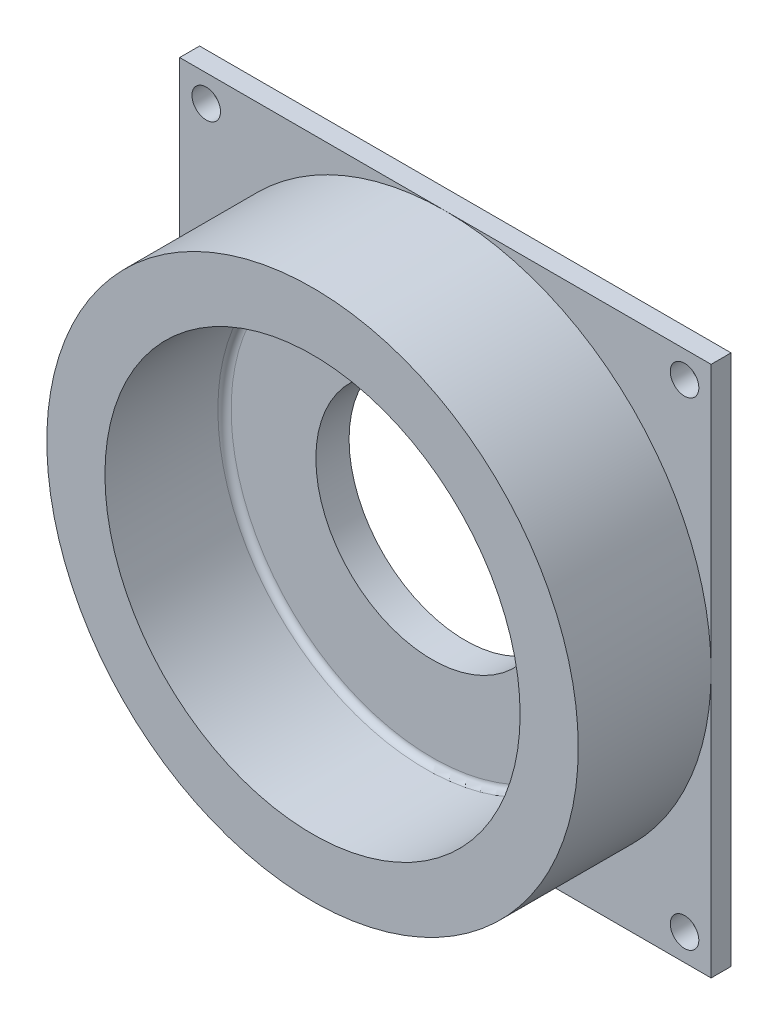
from build123d import *

# Parameters (mm, degrees)
ESQUISSE1_R                  = 40
BOSS_EXTRU_1_DEPTH           = 20
ENL_V_START                  = 20
ESQUISSE2_R                  = 31.25
ENL_V_MAT_EXTRU_1_DEPTH      = 18
CONG_3_R                     = 1
ESQUISSE4_W                  = 80
ESQUISSE4_H                  = 80
BOSS_EXTRU_2_DEPTH           = 3
ENL_V_MAT_EXTRU_2_DEPTH      = 61
ENL_V_MAT_EXTRU_2_DEPTH_BACK = 61
ESQUISSE5_R                  = 17.5
D_GAGEMENT_M41_D             = 4.3
SYM_TRIE2_COPY_1_D           = 4.3


with BuildPart() as part:
    # Esquisse1 → Boss.-Extru.1 (new body)
    with BuildSketch(Plane.XY):
        Circle(ESQUISSE1_R)
    extrude(amount=BOSS_EXTRU_1_DEPTH)

    # Esquisse2 → Enlèv. mat.-Extru.1 (cut)
    with BuildSketch(Plane.XY.offset(ENL_V_START)):
        Circle(ESQUISSE2_R)
    extrude(amount=-ENL_V_MAT_EXTRU_1_DEPTH, mode=Mode.SUBTRACT)

    # Congé3
    cong_3_edges = [part.edges().sort_by_distance(p)[0] for p in [
        (-31.25, 0, 2),
    ]]
    fillet(cong_3_edges, radius=CONG_3_R)

    # Esquisse4 → Boss.-Extru.2 (add)
    with BuildSketch(Plane.XY):
        Rectangle(ESQUISSE4_W, ESQUISSE4_H)
    extrude(amount=-BOSS_EXTRU_2_DEPTH)

    # Esquisse5 → Enlèv. mat.-Extru.2 (cut, two sides: drawn at the far end of the back side and taken through both)
    with BuildSketch(Plane.XY.offset(-ENL_V_MAT_EXTRU_2_DEPTH_BACK)):
        Circle(ESQUISSE5_R)
    extrude(amount=ENL_V_MAT_EXTRU_2_DEPTH + ENL_V_MAT_EXTRU_2_DEPTH_BACK, mode=Mode.SUBTRACT)

    # Dégagement M41 (through all)
    with Locations(Plane(origin=(-36, 36, 0), x_dir=(1, 0, 0), z_dir=(0, 0, 1))):
        with Locations((0, 0)):
            d_gagement_m41 = Hole(D_GAGEMENT_M41_D / 2)

    # Symétrie1: Dégagement M41 across plane
    add(d_gagement_m41.mirror(Plane(origin=(0, 0, 0), x_dir=(0, 0, 1), z_dir=(1, 0, 0))), mode=Mode.SUBTRACT)

    # Symétrie2: Dégagement M41 across plane
    add(d_gagement_m41.mirror(Plane.ZX), mode=Mode.SUBTRACT)

    # Symétrie2 copy 1 (through all)
    with Locations(Plane(origin=(36, -36, 0), x_dir=(-1, 0, 0), z_dir=(0, 0, 1))):
        with Locations((0, 0)):
            Hole(SYM_TRIE2_COPY_1_D / 2)


solid = part.part
